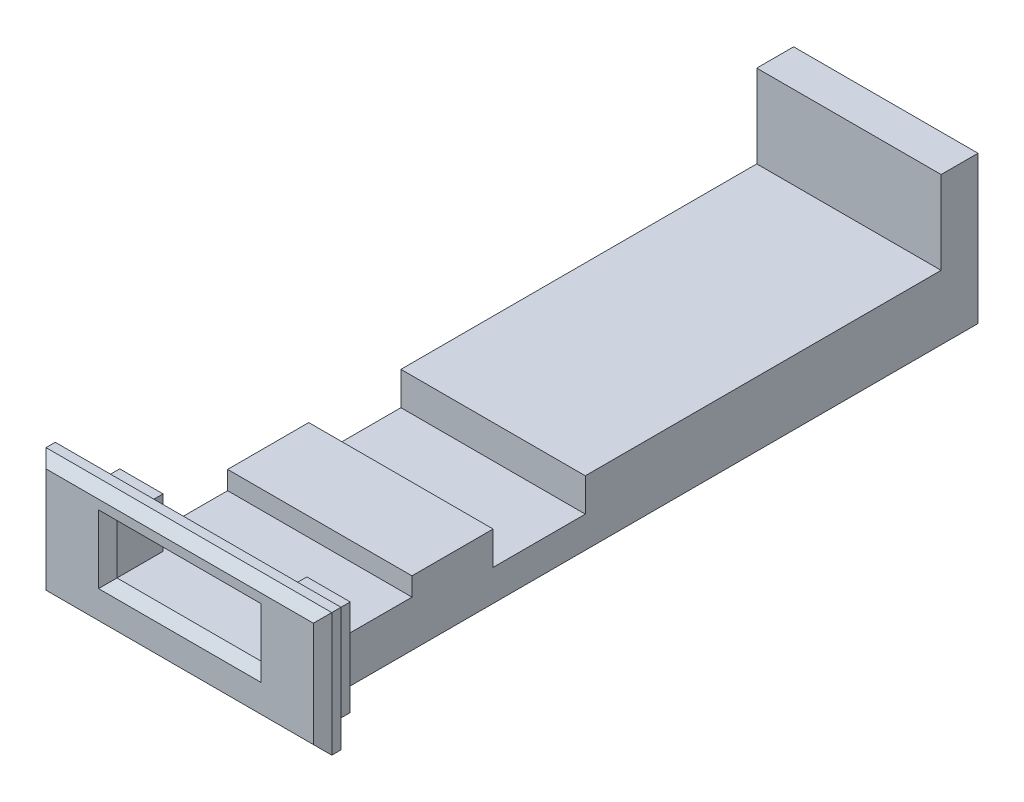
from build123d import *

# Parameters (mm, degrees)
SKETCH1_W               = 12.5
SKETCH1_H               = 5.2
BOSS_EXTRUDE1_DEPTH     = 2
SKETCH2_W               = 7.8
SKETCH2_H               = 2
CUT_EXTRUDE1_DEPTH      = 2.7
SKETCH3_W               = 10
SKETCH3_H               = 2.5
BOSS_EXTRUDE2_DEPTH     = 4.6
SKETCH4_W               = 10
SKETCH4_H               = 3.5
BOSS_EXTRUDE3_DEPTH     = 28.7
SKETCH5_W               = 10
SKETCH5_H               = 8
BOSS_EXTRUDE4_DEPTH     = 2
CUT_EXTRUDE2_DEPTH      = 37.730811317
CUT_EXTRUDE2_DEPTH_BACK = 37.730811317
SKETCH6_W               = 5
SKETCH6_H               = 2
SKETCH7_W               = 15.5
SKETCH7_H               = 6.7
SKETCH7_W_2             = 7.8
SKETCH7_H_2             = 2.7
BOSS_EXTRUDE5_DEPTH     = 1
CHAMFER1_SIZE           = 0.5


with BuildPart() as part:
    # Sketch1 → Boss-Extrude1 (new body)
    with BuildSketch(Plane.XY):
        with Locations((0, 2.6)):
            Rectangle(SKETCH1_W, SKETCH1_H)
    extrude(amount=BOSS_EXTRUDE1_DEPTH)

    # Sketch2 → Cut-Extrude1 (cut)
    with BuildSketch(Plane(origin=(0, 5.2, 0), x_dir=(1, 0, 0), z_dir=(0, 1, 0))):
        with Locations((0, -1)):
            Rectangle(SKETCH2_W, SKETCH2_H)
    extrude(amount=-CUT_EXTRUDE1_DEPTH, mode=Mode.SUBTRACT)

    # Sketch3 → Boss-Extrude2 (add)
    with BuildSketch(Plane(origin=(0, 0, 0), x_dir=(-1, 0, 0), z_dir=(0, 0, -1))):
        with Locations((0, 1.25)):
            Rectangle(SKETCH3_W, SKETCH3_H)
    extrude(amount=BOSS_EXTRUDE2_DEPTH)

    # Sketch4 → Boss-Extrude3 (add)
    with BuildSketch(Plane(origin=(0, 0, -4.6), x_dir=(-1, 0, 0), z_dir=(0, 0, -1))):
        with Locations((0, 1.75)):
            Rectangle(SKETCH4_W, SKETCH4_H)
    extrude(amount=BOSS_EXTRUDE3_DEPTH)

    # Sketch5 → Boss-Extrude4 (add)
    with BuildSketch(Plane(origin=(0, 0, -33.3), x_dir=(-1, 0, 0), z_dir=(0, 0, -1))):
        with Locations((0, 4)):
            Rectangle(SKETCH5_W, SKETCH5_H)
    extrude(amount=BOSS_EXTRUDE4_DEPTH)

    # Sketch6 → Cut-Extrude2 (cut, two sides: drawn at the far end of the back side and taken through both)
    with BuildSketch(Plane(origin=(0, 0, 0), x_dir=(0, 0, -1), z_dir=(1, 0, 0)).offset(-CUT_EXTRUDE2_DEPTH_BACK)):
        with Locations((11.5, 2.698552558)):
            Rectangle(SKETCH6_W, SKETCH6_H)
    extrude(amount=CUT_EXTRUDE2_DEPTH + CUT_EXTRUDE2_DEPTH_BACK, mode=Mode.SUBTRACT)

    # Sketch7 → Boss-Extrude5 (add)
    with BuildSketch(Plane.XY.offset(2)):
        with Locations((0, 3.35)):
            Rectangle(SKETCH7_W, SKETCH7_H)
        with Locations((0, 3.85)):
            Rectangle(SKETCH7_W_2, SKETCH7_H_2, mode=Mode.SUBTRACT)
    extrude(amount=BOSS_EXTRUDE5_DEPTH)

    # Chamfer1
    chamfer1_edges = [part.edges().sort_by_distance(p)[0] for p in [
        (0, 5.2, 3),
        (-7.75, 3.35, 3),
        (0, 0, 3),
        (7.75, 3.35, 3),
        (0, 6.7, 3),
        (-3.9, 3.85, 3),
        (0, 2.5, 3),
        (3.9, 3.85, 3),
    ]]
    chamfer(chamfer1_edges, length=CHAMFER1_SIZE)


solid = part.part
